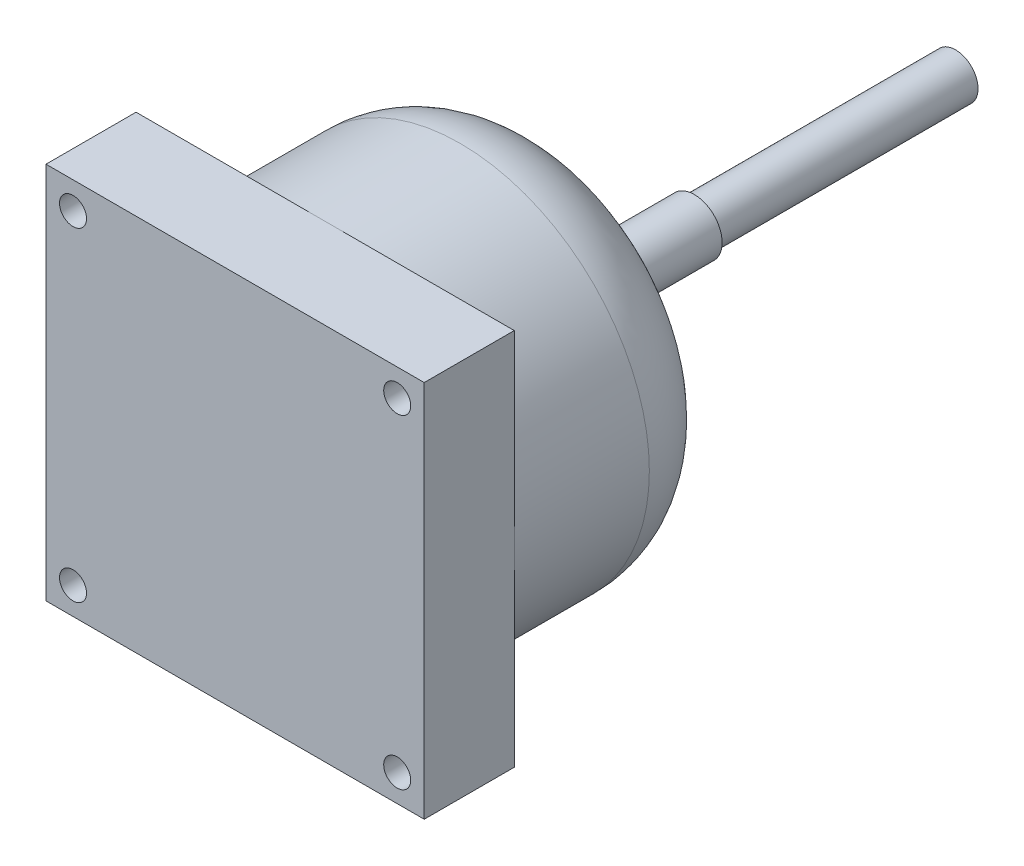
from build123d import *

# Parameters (mm, degrees)
ESBO_O1_R                = 21
RESSALTO_EXTRUS_O1_DEPTH = 46
FILETE1_R                = 10
ESBO_O2_R                = 3.079372868
RESSALTO_EXTRUS_O2_DEPTH = 16
ESBO_O3_R                = 2.5
RESSALTO_EXTRUS_O3_DEPTH = 29
RESSALTO_EXTRUS_O4_DEPTH = 10
ESBO_O5_R                = 21
CORTE_EXTRUS_O2_DEPTH    = 101.029128289
ESBO_O6_R                = 21
RESSALTO_EXTRUS_O5_DEPTH = 10
ESBO_O7_R                = 1.5
CORTE_EXTRUS_O3_DEPTH    = 101.029128289


with BuildPart() as part:
    # Esboço1 → Ressalto-extrusão1 (new body)
    with BuildSketch(Plane.XY):
        with Locations((-33.295415682, 25.452495544)):
            Circle(ESBO_O1_R)
    extrude(amount=RESSALTO_EXTRUS_O1_DEPTH)

    # Filete1
    filete1_edges = [part.edges().sort_by_distance(p)[0] for p in [
        (-54.295415682, 25.452495544, 0),
        (-54.295415682, 25.452495544, 46),
    ]]
    fillet(filete1_edges, radius=FILETE1_R)

    # Esboço2 → Ressalto-extrusão2 (add)
    with BuildSketch(Plane(origin=(0, 0, 0), x_dir=(-1, 0, 0), z_dir=(0, 0, -1))):
        with Locations(Location((33.295415682, 25.452495544, 0), (0, 0, 180))):
            Circle(ESBO_O2_R)
    extrude(amount=RESSALTO_EXTRUS_O2_DEPTH)

    # Esboço3 → Ressalto-extrusão3 (add)
    with BuildSketch(Plane(origin=(0, 0, -16), x_dir=(-1, 0, 0), z_dir=(0, 0, -1))):
        with Locations((33.295415682, 25.452495544)):
            Circle(ESBO_O3_R)
    extrude(amount=RESSALTO_EXTRUS_O3_DEPTH)

    # Esboço4 → Ressalto-extrusão4 (add)
    with BuildSketch(Plane.XY.offset(25)):
        Polygon((-33.295415682, 46.452495544), (-12.295415682, 46.452495544), (-12.295415682, 4.452495544), (-54.295415682, 4.452495544), (-54.295415682, 46.452495544), align=None)
    extrude(amount=RESSALTO_EXTRUS_O4_DEPTH)

    # Esboço5 → Corte-extrusão2 (cut, through all)
    with BuildSketch(Plane.XY.offset(25)):
        with Locations(Location((-33.295415682, 25.452495544, 0), (0, 0, 180))):
            Circle(ESBO_O5_R)
    extrude(amount=CORTE_EXTRUS_O2_DEPTH, mode=Mode.SUBTRACT)


with BuildPart() as corte_extrus_o2_piece_1:
    # of the separate pieces the step leaves, piece 1, a body of its own (corte_extrus_o2_pieces)
    add(part.part.solids().sort_by_distance((-12.295415682, 25.452495544, 10))[0])



with BuildPart() as corte_extrus_o2_piece_2:
    # of the separate pieces the step leaves, piece 2, a body of its own (corte_extrus_o2_pieces)
    add(part.part.solids().sort_by_distance((-54.295415682, 46.452495544, 25))[0])


with BuildPart() as corte_extrus_o2_piece_3:
    # of the separate pieces the step leaves, piece 3, a body of its own (corte_extrus_o2_pieces)
    add(part.part.solids().sort_by_distance((-54.295415682, 4.452495544, 25))[0])


with BuildPart() as corte_extrus_o2_piece_4:
    # of the separate pieces the step leaves, piece 4, a body of its own (corte_extrus_o2_pieces)
    add(part.part.solids().sort_by_distance((-12.295415682, 46.452495544, 25))[0])


with BuildPart() as corte_extrus_o2_piece_5:
    # of the separate pieces the step leaves, piece 5, a body of its own (corte_extrus_o2_pieces)
    add(part.part.solids().sort_by_distance((-12.295415682, 4.452495544, 25))[0])


with BuildPart() as corte_extrus_o2_piece_1_1:
    add(corte_extrus_o2_piece_1.part)

    add(corte_extrus_o2_piece_2.part)  # Ressalto-extrusão5 merges Corte-extrusão2 piece 2

    add(corte_extrus_o2_piece_3.part)  # Ressalto-extrusão5 merges Corte-extrusão2 piece 3

    add(corte_extrus_o2_piece_4.part)  # Ressalto-extrusão5 merges Corte-extrusão2 piece 4

    add(corte_extrus_o2_piece_5.part)  # Ressalto-extrusão5 merges Corte-extrusão2 piece 5
    # Esboço6 → Ressalto-extrusão5 (add)
    with BuildSketch(Plane.XY.offset(25)):
        with Locations((-33.295415682, 25.452495544)):
            Circle(ESBO_O6_R)
    extrude(amount=RESSALTO_EXTRUS_O5_DEPTH)

    # Esboço7 → Corte-extrusão3 (cut, through all)
    with BuildSketch(Plane(origin=(0, 0, 25), x_dir=(-1, 0, 0), z_dir=(0, 0, -1))):
        with Locations((15.295415682, 43.452495544)):
            Circle(ESBO_O7_R)
        with Locations((51.295415682, 43.452495544)):
            Circle(ESBO_O7_R)
        with Locations((51.295415682, 7.452495544)):
            Circle(ESBO_O7_R)
        with Locations((15.295415682, 7.452495544)):
            Circle(ESBO_O7_R)
    extrude(amount=-CORTE_EXTRUS_O3_DEPTH, mode=Mode.SUBTRACT)


solid = corte_extrus_o2_piece_1_1.part
